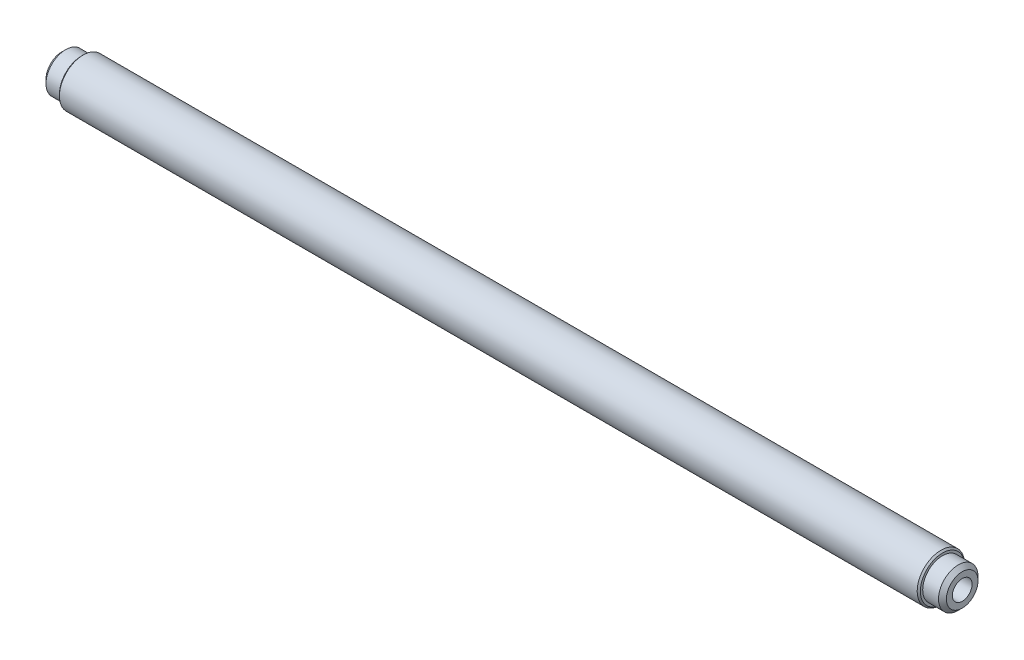
from build123d import *

# Parameters (mm, degrees)
TAPPED_HOLE1_D     = 2.5
TAPPED_HOLE1_DEPTH = 8.5
TAPPED_HOLE1_TIP   = 0.751075774
TAPPED_HOLE2_D     = 2.5
TAPPED_HOLE2_DEPTH = 8.5
TAPPED_HOLE2_TIP   = 0.751075774
CHAMFER1_SIZE      = 0.2
CHAMFER2_SIZE      = 0.2
CHAMFER3_SIZE      = 0.5


with BuildPart() as part:
    # Sketch1 → Revolve1 (revolve)
    with BuildSketch(Plane.XY):
        Polygon((0, 0), (114, 0), (114, 2.5), (111.5, 2.5), (111.5, 3), (2.5, 3), (2.5, 2.5), (0, 2.5), align=None)
    revolve(axis=Axis((0, 0, 0), (1, 0, 0)))

    # Tapped Hole1
    with Locations(Plane.ZY):
        with Locations((0, 0)):
            Hole(TAPPED_HOLE1_D / 2, depth=TAPPED_HOLE1_DEPTH)
            with Locations((0, 0, -(TAPPED_HOLE1_DEPTH + TAPPED_HOLE1_TIP / 2))):  # 118° drill point
                Cone(0, TAPPED_HOLE1_D / 2, TAPPED_HOLE1_TIP, mode=Mode.SUBTRACT)

    # Tapped Hole2
    with Locations(Plane(origin=(114, 0, 0), x_dir=(0, 0, -1), z_dir=(1, 0, 0))):
        with Locations((0, 0)):
            Hole(TAPPED_HOLE2_D / 2, depth=TAPPED_HOLE2_DEPTH)
            with Locations((0, 0, -(TAPPED_HOLE2_DEPTH + TAPPED_HOLE2_TIP / 2))):  # 118° drill point
                Cone(0, TAPPED_HOLE2_D / 2, TAPPED_HOLE2_TIP, mode=Mode.SUBTRACT)

    # Chamfer1
    chamfer1_edges = [part.edges().sort_by_distance(p)[0] for p in [
        (111.5, -3, 0),
    ]]
    chamfer(chamfer1_edges, length=CHAMFER1_SIZE)

    # Chamfer2
    chamfer2_edges = [part.edges().sort_by_distance(p)[0] for p in [
        (2.5, -3, 0),
    ]]
    chamfer(chamfer2_edges, length=CHAMFER2_SIZE)

    # Chamfer3
    chamfer3_edges = [part.edges().sort_by_distance(p)[0] for p in [
        (114, -2.5, 0),
        (0, -2.5, 0),
    ]]
    chamfer(chamfer3_edges, length=CHAMFER3_SIZE)


solid = part.part
